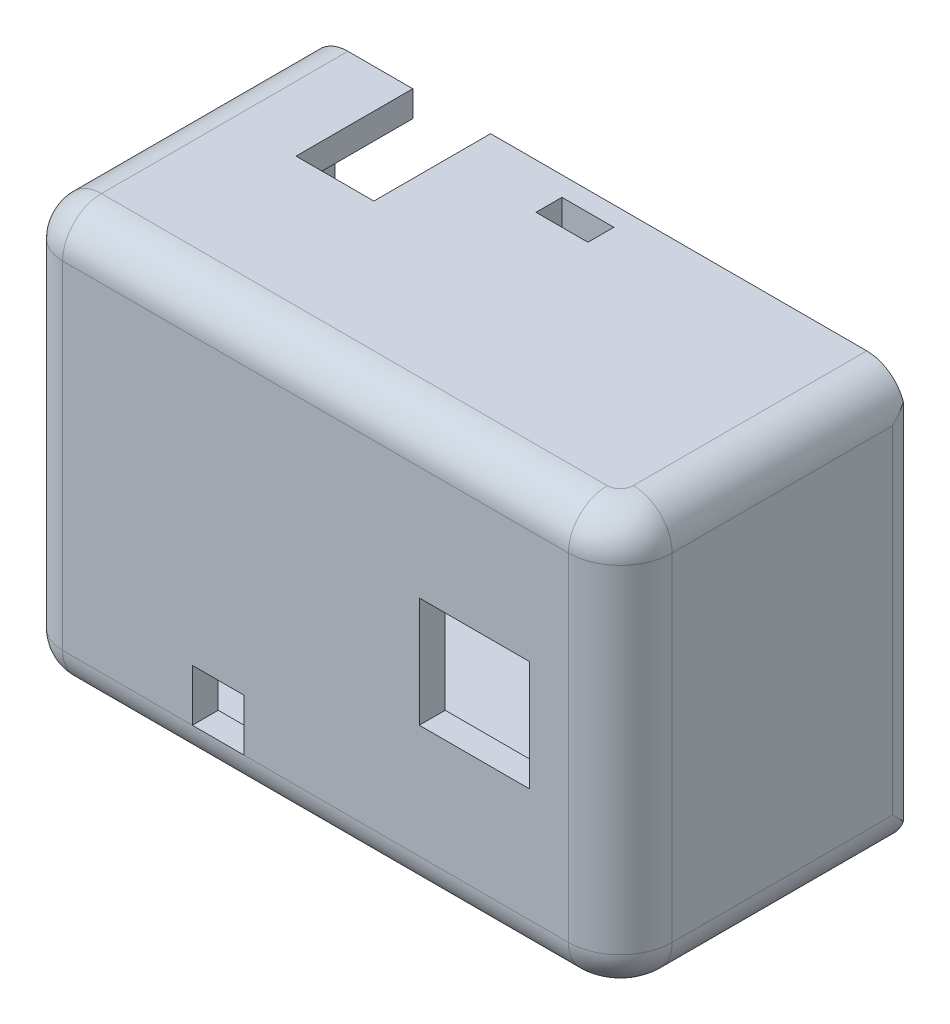
from build123d import *

# Parameters (mm, degrees)
SKETCH1_W                = 46
SKETCH1_H                = 32
SKETCH1_W_2              = 42
SKETCH1_H_2              = 28
BOSS_EXTRUDE1_DEPTH      = 20
SKETCH2_W                = 46
SKETCH2_H                = 32
BOSS_EXTRUDE2_DEPTH      = 2
SKETCH3_W                = 8
SKETCH3_H                = 4
CUT_EXTRUDE2_DEPTH       = 58.965506985
SKETCH4_W                = 5
SKETCH4_H                = 5
CUT_EXTRUDE3_DEPTH       = 2
SKETCH5_W                = 46
SKETCH5_H                = 32
BOSS_EXTRUDE3_DEPTH      = 2
SKETCH6_W                = 8.5
SKETCH6_H                = 4.25
CUT_EXTRUDE4_DEPTH       = 2
SKETCH7_W                = 11.5
SKETCH7_H                = 11.5
SKETCH7_W_2              = 8.5
SKETCH7_H_2              = 8.5
BOSS_EXTRUDE5_DEPTH      = 2
SKETCH9_R                = 5.75
SKETCH9_R_2              = 5
BOSS_EXTRUDE8_DEPTH      = 4
BOSS_EXTRUDE9_DEPTH      = 0.5
FILLET2_R                = 4
FILLET3_R                = 3
FILLET4_R                = 2
SKETCH13_W               = 43
SKETCH13_H               = 32
CUT_EXTRUDE5_DEPTH       = 2
SKETCH14_W               = 2
SKETCH14_H               = 32
CUT_EXTRUDE6_DEPTH       = 2
SKETCH15_W               = 4
SKETCH15_H               = 4
CUT_EXTRUDE9_DEPTH       = 2
SKETCH16_W               = 1.236067977
SKETCH16_H               = 30.472135954
CUT_EXTRUDE10_DEPTH      = 2
FILLET9_R                = 3
CUT_EXTRUDE11_DEPTH      = 62.188234163
CUT_EXTRUDE11_DEPTH_BACK = 62.188234163
SKETCH19_W               = 4
SKETCH19_H               = 2
SKETCH21_W               = 2
SKETCH21_H               = 4
CUT_EXTRUDE12_DEPTH      = 55
SKETCH22_W               = 4
SKETCH22_H               = 4
BOSS_EXTRUDE10_DEPTH     = 2
SKETCH23_W               = 4
SKETCH23_H               = 4
BOSS_EXTRUDE11_DEPTH     = 2
SKETCH24_W               = 6
SKETCH24_H               = 5
CUT_EXTRUDE13_DEPTH      = 46.5
SKETCH25_W               = 5
SKETCH25_H               = 10
CUT_EXTRUDE14_DEPTH      = 13
CUT_EXTRUDE15_START      = -3.5
SKETCH26_R               = 6.5
SKETCH26_R_2             = 5
CUT_EXTRUDE15_DEPTH      = 3.5
SKETCH27_W               = 11.5
SKETCH27_H               = 11.5
CUT_EXTRUDE16_DEPTH      = 2.5


with BuildPart() as part:
    # Sketch1 → Boss-Extrude1 (new body)
    with BuildSketch(Plane.XY):
        with Locations((21, -14)):
            Rectangle(SKETCH1_W, SKETCH1_H)
        with Locations((21, -14)):
            Rectangle(SKETCH1_W_2, SKETCH1_H_2, mode=Mode.SUBTRACT)
    extrude(amount=BOSS_EXTRUDE1_DEPTH)

    # Sketch2 → Boss-Extrude2 (add)
    with BuildSketch(Plane(origin=(0, 0, 0), x_dir=(-1, 0, 0), z_dir=(0, 0, -1))):
        with Locations((-21, -14)):
            Rectangle(SKETCH2_W, SKETCH2_H)
    extrude(amount=BOSS_EXTRUDE2_DEPTH)

    # Sketch3 → Cut-Extrude2 (cut, through all)
    with BuildSketch(Plane.XZ.offset(30)):
        with Locations((6, 2)):
            Rectangle(SKETCH3_W, SKETCH3_H)
    extrude(amount=-CUT_EXTRUDE2_DEPTH, mode=Mode.SUBTRACT)

    # Sketch4 → Cut-Extrude3 (cut)
    with BuildSketch(Plane.ZY.offset(2)):
        with Locations((2.5, -11.5)):
            Rectangle(SKETCH4_W, SKETCH4_H)
        with Locations((2.5, -16.5)):
            Rectangle(SKETCH4_W, SKETCH4_H)
    extrude(amount=-CUT_EXTRUDE3_DEPTH, mode=Mode.SUBTRACT)

    # Sketch5 → Boss-Extrude3 (add)
    with BuildSketch(Plane.XY.offset(20)):
        with Locations((21, -14)):
            Rectangle(SKETCH5_W, SKETCH5_H)
    extrude(amount=BOSS_EXTRUDE3_DEPTH)

    # Sketch6 → Cut-Extrude4 (cut)
    with BuildSketch(Plane.XY.offset(22)):
        with Locations((32.75, -11.875)):
            Rectangle(SKETCH6_W, SKETCH6_H)
        with Locations((32.75, -16.125)):
            Rectangle(SKETCH6_W, SKETCH6_H)
    extrude(amount=-CUT_EXTRUDE4_DEPTH, mode=Mode.SUBTRACT)

    # Sketch7 → Boss-Extrude5 (add)
    with BuildSketch(Plane.XY.offset(22)):
        with Locations((32.75, -14)):
            Rectangle(SKETCH7_W, SKETCH7_H)
        with Locations((32.75, -14)):
            Rectangle(SKETCH7_W_2, SKETCH7_H_2, mode=Mode.SUBTRACT)
    extrude(amount=BOSS_EXTRUDE5_DEPTH)

    # Sketch9 → Boss-Extrude8 (add)
    with BuildSketch(Plane.XY.offset(24)):
        with Locations((32.75, -14)):
            Circle(SKETCH9_R)
        with Locations(Location((32.75, -14, 0), (0, 0, 211.788330617))):
            Circle(SKETCH9_R_2, mode=Mode.SUBTRACT)
    extrude(amount=BOSS_EXTRUDE8_DEPTH)

    # Sketch11 → Boss-Extrude9 (add)
    with BuildSketch(Plane.XY.offset(24)):
        with BuildLine():
            Line((38.5, -19.75), (38.5, -14))
            ThreePointArc((38.5, -14), (38.111902647, -16.076655966), (37, -17.872983346))
            Line((37, -17.872983346), (37, -18.25))
            Line((37, -18.25), (36.622983346, -18.25))
            ThreePointArc((36.622983346, -18.25), (34.826655966, -19.361902647), (32.75, -19.75))
            Line((32.75, -19.75), (38.5, -19.75))
        make_face()
        with BuildLine():
            Line((27, -19.75), (29.718911087, -19.75))
            ThreePointArc((29.718911087, -19.75), (28.153805922, -18.596194078), (27, -17.031088913))
            Line((27, -17.031088913), (27, -19.75))
        make_face()
        with BuildLine():
            Line((38.5, -10.968911087), (38.5, -8.25))
            Line((38.5, -8.25), (35.781088913, -8.25))
            ThreePointArc((35.781088913, -8.25), (37.346194078, -9.403805922), (38.5, -10.968911087))
        make_face()
        with BuildLine():
            Line((27, -8.25), (27, -10.968911087))
            ThreePointArc((27, -10.968911087), (28.153805922, -9.403805922), (29.718911087, -8.25))
            Line((29.718911087, -8.25), (27, -8.25))
        make_face()
    extrude(amount=BOSS_EXTRUDE9_DEPTH)

    # Fillet2
    fillet2_edges = [part.edges().sort_by_distance(p)[0] for p in [
        (44, -14, 22),
    ]]
    fillet(fillet2_edges, radius=FILLET2_R)

    # Fillet3
    fillet3_edges = [part.edges().sort_by_distance(p)[0] for p in [
        (19, 2, 22),
        (44, 2, 8),
        (42.828427125, 2, 20.828427125),
        (44, -30, 8),
        (42.828427125, -30, 20.828427125),
        (44, -14, -2),
        (19, -30, 22),
    ]]
    fillet(fillet3_edges, radius=FILLET3_R)

    # Fillet4
    fillet4_edges = [part.edges().sort_by_distance(p)[0] for p in [
        (27, -8.25, 23.25),
        (27, -19.75, 23.25),
        (38.5, -19.75, 23.25),
        (38.5, -8.25, 23.25),
    ]]
    fillet(fillet4_edges, radius=FILLET4_R)

    # Sketch13 → Cut-Extrude5 (cut)
    with BuildSketch(Plane(origin=(0, 0, -2), x_dir=(-1, 0, 0), z_dir=(0, 0, -1))):
        with Locations((-19.5, -14)):
            Rectangle(SKETCH13_W, SKETCH13_H)
    extrude(amount=-CUT_EXTRUDE5_DEPTH, mode=Mode.SUBTRACT)

    # Sketch14 → Cut-Extrude6 (cut)
    with BuildSketch(Plane.ZY.offset(-41)):
        with Locations((-1, -14)):
            Rectangle(SKETCH14_W, SKETCH14_H)
    extrude(amount=-CUT_EXTRUDE6_DEPTH, mode=Mode.SUBTRACT)

    # Sketch15 → Cut-Extrude9 (cut)
    with BuildSketch(Plane.XY.offset(22)):
        with Locations((13, -25)):
            Rectangle(SKETCH15_W, SKETCH15_H)
    extrude(amount=-CUT_EXTRUDE9_DEPTH, mode=Mode.SUBTRACT)

    # Sketch16 → Cut-Extrude10 (cut)
    with BuildSketch(Plane.ZY.offset(-43)):
        with Locations((-0.618033989, -14)):
            Rectangle(SKETCH16_W, SKETCH16_H)
    extrude(amount=-CUT_EXTRUDE10_DEPTH, mode=Mode.SUBTRACT)

    # Fillet9
    fillet9_edges = [part.edges().sort_by_distance(p)[0] for p in [
        (-2, -14, 22),
        (-2, -30, 9.5),
        (-2, 2, 9.5),
        (-2, 1.121320344, 21.121320344),
        (-2, -29.121320344, 21.121320344),
    ]]
    fillet(fillet9_edges, radius=FILLET9_R)

    # Sketch19 → Cut-Extrude11 (cut, two sides: drawn at the far end of the back side and taken through both)
    with BuildSketch(Plane.XZ.offset(30).offset(-CUT_EXTRUDE11_DEPTH_BACK)):
        with Locations((21, 2.5)):
            Rectangle(SKETCH19_W, SKETCH19_H)
    extrude(amount=CUT_EXTRUDE11_DEPTH + CUT_EXTRUDE11_DEPTH_BACK, mode=Mode.SUBTRACT)

    # Sketch21 → Cut-Extrude12 (cut, symmetric)
    with BuildSketch(Plane(origin=(0, 2, 0), x_dir=(1, 0, 0), z_dir=(0, 1, 0))):
        with Locations((11, -2)):
            Rectangle(SKETCH21_W, SKETCH21_H)
    extrude(amount=CUT_EXTRUDE12_DEPTH, both=True, mode=Mode.SUBTRACT)

    # Sketch22 → Boss-Extrude10 (add)
    with BuildSketch(Plane(origin=(0, 2, 0), x_dir=(1, 0, 0), z_dir=(0, 1, 0))):
        with Locations((4, -2)):
            Rectangle(SKETCH22_W, SKETCH22_H)
    extrude(amount=-BOSS_EXTRUDE10_DEPTH)

    # Sketch23 → Boss-Extrude11 (add)
    with BuildSketch(Plane.XZ.offset(30)):
        with Locations((4, 2)):
            Rectangle(SKETCH23_W, SKETCH23_H)
    extrude(amount=-BOSS_EXTRUDE11_DEPTH)

    # Sketch24 → Cut-Extrude13 (cut, symmetric)
    with BuildSketch(Plane.XZ.offset(30)):
        with Locations((9, 6.5)):
            Rectangle(SKETCH24_W, SKETCH24_H)
    extrude(amount=CUT_EXTRUDE13_DEPTH, both=True, mode=Mode.SUBTRACT)

    # Sketch25 → Cut-Extrude14 (cut)
    with BuildSketch(Plane.ZY.offset(2)):
        with Locations((7.5, -14)):
            Rectangle(SKETCH25_W, SKETCH25_H)
    extrude(amount=-CUT_EXTRUDE14_DEPTH, mode=Mode.SUBTRACT)

    # Sketch26 → Cut-Extrude15 (cut)
    with BuildSketch(Plane.XY.offset(28).offset(CUT_EXTRUDE15_START)):
        with Locations((32.75, -14)):
            Circle(SKETCH26_R)
        with Locations(Location((32.75, -14, 0), (0, 0, 211.788330617))):
            Circle(SKETCH26_R_2, mode=Mode.SUBTRACT)
    extrude(amount=CUT_EXTRUDE15_DEPTH, mode=Mode.SUBTRACT)

    # Sketch27 → Cut-Extrude16 (cut)
    with BuildSketch(Plane.XY.offset(24.5)):
        with Locations((32.75, -14)):
            Rectangle(SKETCH27_W, SKETCH27_H)
    extrude(amount=-CUT_EXTRUDE16_DEPTH, mode=Mode.SUBTRACT)


solid = part.part
